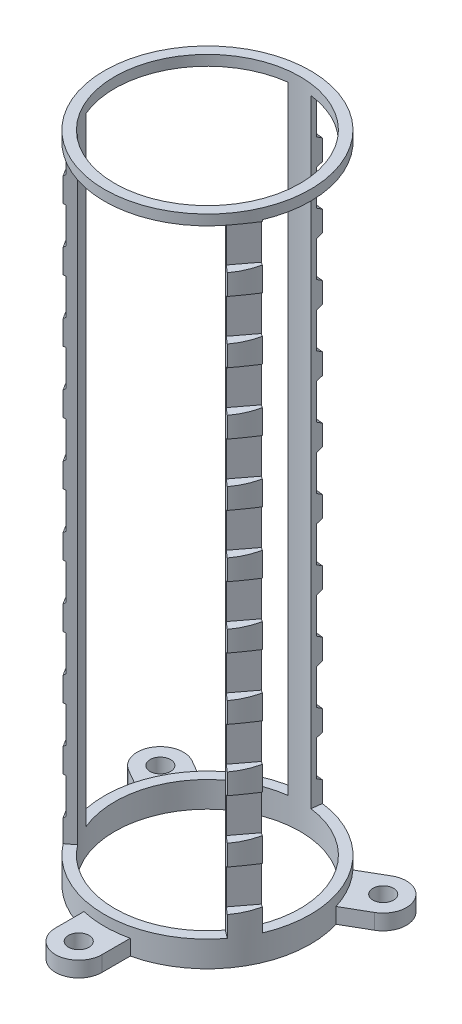
from build123d import *
from build123d.topology import SkipClean

# Parameters (mm, degrees)
SKETCH1_R           = 2
SKETCH1_R_2         = 18
BOSS_EXTRUDE1_DEPTH = 5
CUT_EXTRUDE1_START  = -2
SKETCH2_R           = 29.5
SKETCH2_R_2         = 20
CUT_EXTRUDE1_DEPTH  = 2
BOSS_EXTRUDE2_DEPTH = 120
SKETCH4_R           = 20
SKETCH4_R_2         = 18
BOSS_EXTRUDE3_DEPTH = 2
CUT_EXTRUDE2_DEPTH  = 12
CIRPATTERN1_COUNT   = 3


with BuildPart() as part:
    # Sketch1 → Boss-Extrude1 (new body)
    with BuildSketch(Plane(origin=(0, 0, 0), x_dir=(1, 0, 0), z_dir=(0, 1, 0))):
        with BuildLine():
            ThreePointArc((4.5, -19.48717527), (17.320508076, -10), (19.126388832, 5.846473318))
            Line((19.126388832, 5.846473318), (23.900635095, 8.602885683))
            ThreePointArc((23.900635095, 8.602885683), (25.547749412, 14.75), (19.400635095, 16.397114317))
            Line((19.400635095, 16.397114317), (14.626388832, 13.640701952))
            ThreePointArc((14.626388832, 13.640701952), (0, 20), (-14.626388832, 13.640701952))
            Line((-14.626388832, 13.640701952), (-19.400635095, 16.397114317))
            ThreePointArc((-19.400635095, 16.397114317), (-25.547749412, 14.75), (-23.900635095, 8.602885683))
            Line((-23.900635095, 8.602885683), (-19.126388832, 5.846473318))
            ThreePointArc((-19.126388832, 5.846473318), (-17.320508076, -10), (-4.5, -19.48717527))
            Line((-4.5, -19.48717527), (-4.5, -25))
            ThreePointArc((-4.5, -25), (0, -29.5), (4.5, -25))
            Line((4.5, -25), (4.5, -19.48717527))
        make_face()
        with Locations(Location((0, -25, 0), (0, 0, 270))):
            Circle(SKETCH1_R, mode=Mode.SUBTRACT)
        with Locations(Location((-21.650635095, 12.5, 0), (0, 0, 270))):
            Circle(SKETCH1_R, mode=Mode.SUBTRACT)
        with Locations(Location((0, 0, 0), (0, 0, 270))):
            Circle(SKETCH1_R_2, mode=Mode.SUBTRACT)
        with Locations(Location((21.650635095, 12.5, 0), (0, 0, 270))):
            Circle(SKETCH1_R, mode=Mode.SUBTRACT)
    extrude(amount=BOSS_EXTRUDE1_DEPTH)

    # Sketch2 → Cut-Extrude1 (cut)
    with BuildSketch(Plane(origin=(0, 5, 0), x_dir=(1, 0, 0), z_dir=(0, 1, 0)).offset(CUT_EXTRUDE1_START)):
        Circle(SKETCH2_R)
        with Locations(Location((0, 0, 0), (0, 0, 136.997121837))):
            Circle(SKETCH2_R_2, mode=Mode.SUBTRACT)
    extrude(amount=CUT_EXTRUDE1_DEPTH, mode=Mode.SUBTRACT)

    # Sketch3 → Boss-Extrude2 (add)
    with BuildSketch(Plane(origin=(0, 5, 0), x_dir=(1, 0, 0), z_dir=(0, 1, 0))):
        with BuildLine():
            Line((18.432747811, -7.761044268), (16.58947303, -6.984939841))
            ThreePointArc((16.58947303, -6.984939841), (15.588457268, -9), (14.343871861, -10.874435159))
            Line((14.343871861, -10.874435159), (15.937635401, -12.082705732))
            ThreePointArc((15.937635401, -12.082705732), (17.320508076, -10), (18.432747811, -7.761044268))
        make_face()
    boss_extrude2 = extrude(amount=BOSS_EXTRUDE2_DEPTH)

    # Sketch4 → Boss-Extrude3 (add)
    with BuildSketch(Plane(origin=(0, 125, 0), x_dir=(1, 0, 0), z_dir=(0, 1, 0))):
        with Locations(Location((0, 0, 0), (0, 0, 136.997121837))):
            Circle(SKETCH4_R)
        with Locations(Location((0, 0, 0), (0, 0, 270))):
            Circle(SKETCH4_R_2, mode=Mode.SUBTRACT)
    extrude(amount=BOSS_EXTRUDE3_DEPTH)

    # Sketch5 → Cut-Extrude2 (cut)
    with BuildSketch(Plane(origin=(0, 0, 0), x_dir=(0.7968817700725616, 0, 0.6041352866089029), z_dir=(-0.6041352866089028, 0, 0.7968817700725614))):
        Polygon((19, 9.596976534), (20, 9), (20, 17), (19, 16.5), align=None)
        Polygon((19, 21.596976534), (20, 21), (20, 29), (19, 28.5), align=None)
        Polygon((19, 33.596976534), (20, 33), (20, 41), (19, 40.5), align=None)
        Polygon((19, 45.596976534), (20, 45), (20, 53), (19, 52.5), align=None)
        Polygon((19, 57.596976534), (20, 57), (20, 65), (19, 64.5), align=None)
        Polygon((19, 69.596976534), (20, 69), (20, 77), (19, 76.5), align=None)
        Polygon((19, 81.596976534), (20, 81), (20, 89), (19, 88.5), align=None)
        Polygon((19, 93.596976534), (20, 93), (20, 101), (19, 100.5), align=None)
        Polygon((19, 105.596976534), (20, 105), (20, 113), (19, 112.5), align=None)
        Polygon((19, 117.596976534), (20, 117), (20, 125), (19, 124.5), align=None)
    cut_extrude2 = extrude(amount=-CUT_EXTRUDE2_DEPTH, mode=Mode.SUBTRACT)

    # CirPattern1: Boss-Extrude2, Cut-Extrude2 ×3 about axis
    with SkipClean():  # the faces are left unmerged after this step: merging them gives an invalid solid
        cirpattern1_axis = Axis((0, 0, 0), (0, 1, 0))
        add([boss_extrude2.rotate(cirpattern1_axis, i * 360 / CIRPATTERN1_COUNT) for i in range(1, CIRPATTERN1_COUNT)])
        add([cut_extrude2.rotate(cirpattern1_axis, i * 360 / CIRPATTERN1_COUNT) for i in range(1, CIRPATTERN1_COUNT)], mode=Mode.SUBTRACT)


solid = part.part
